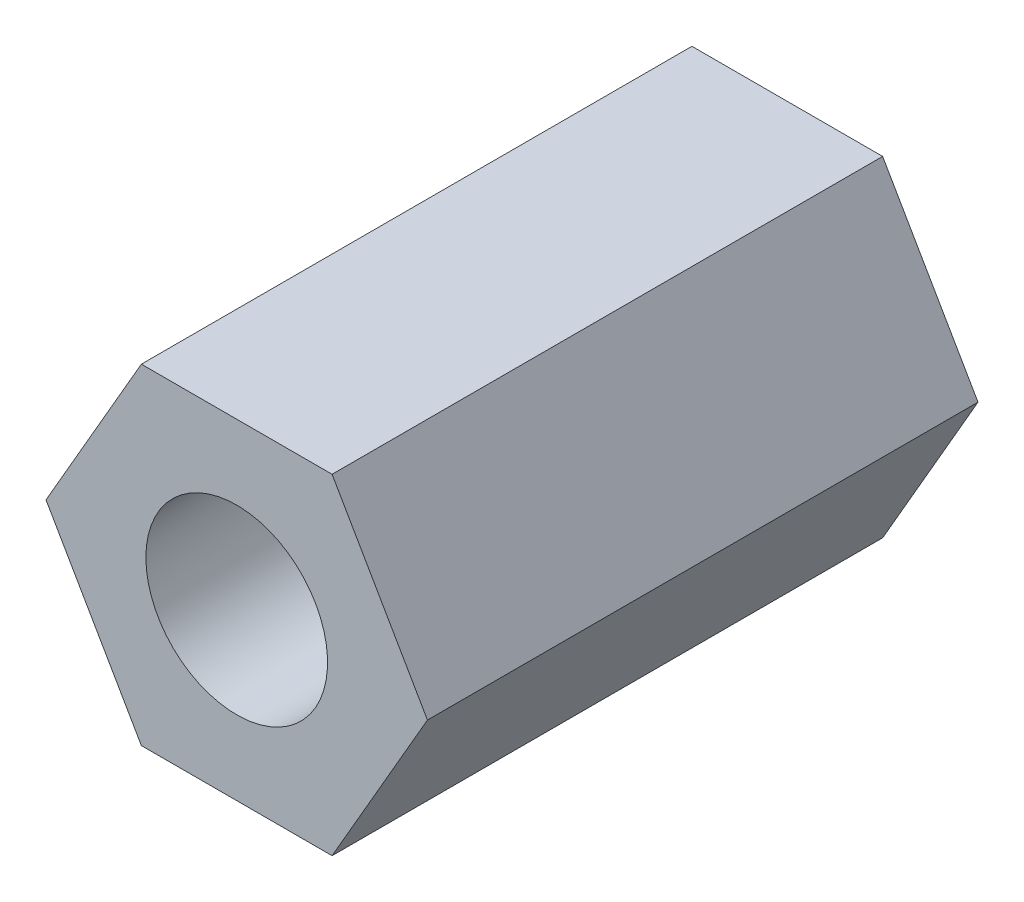
from build123d import *

# Parameters (mm, degrees)
EXTRUDE_1_DEPTH              = 10
HOLE_WIZARD_M4_1_D           = 3.3
HOLE_WIZARD_M4_1_CSINK_D     = 4.05
HOLE_WIZARD_M4_1_CSINK_ANGLE = 90


with BuildPart() as part:
    # 草图1 → 凸台-拉伸1 (new body)
    with BuildSketch(Plane.XY):
        Polygon((3.464101615, 0), (1.732050808, 3), (-1.732050808, 3), (-3.464101615, 0), (-1.732050808, -3), (1.732050808, -3), align=None)
    extrude(amount=EXTRUDE_1_DEPTH)

    # M4 螺纹孔1 (through all)
    with Locations(Plane(origin=(0, 0, 0), x_dir=(-1, 0, 0), z_dir=(0, 0, -1))):
        with Locations((0, 0)):
            CounterSinkHole(HOLE_WIZARD_M4_1_D / 2, HOLE_WIZARD_M4_1_CSINK_D / 2, counter_sink_angle=HOLE_WIZARD_M4_1_CSINK_ANGLE)


solid = part.part
